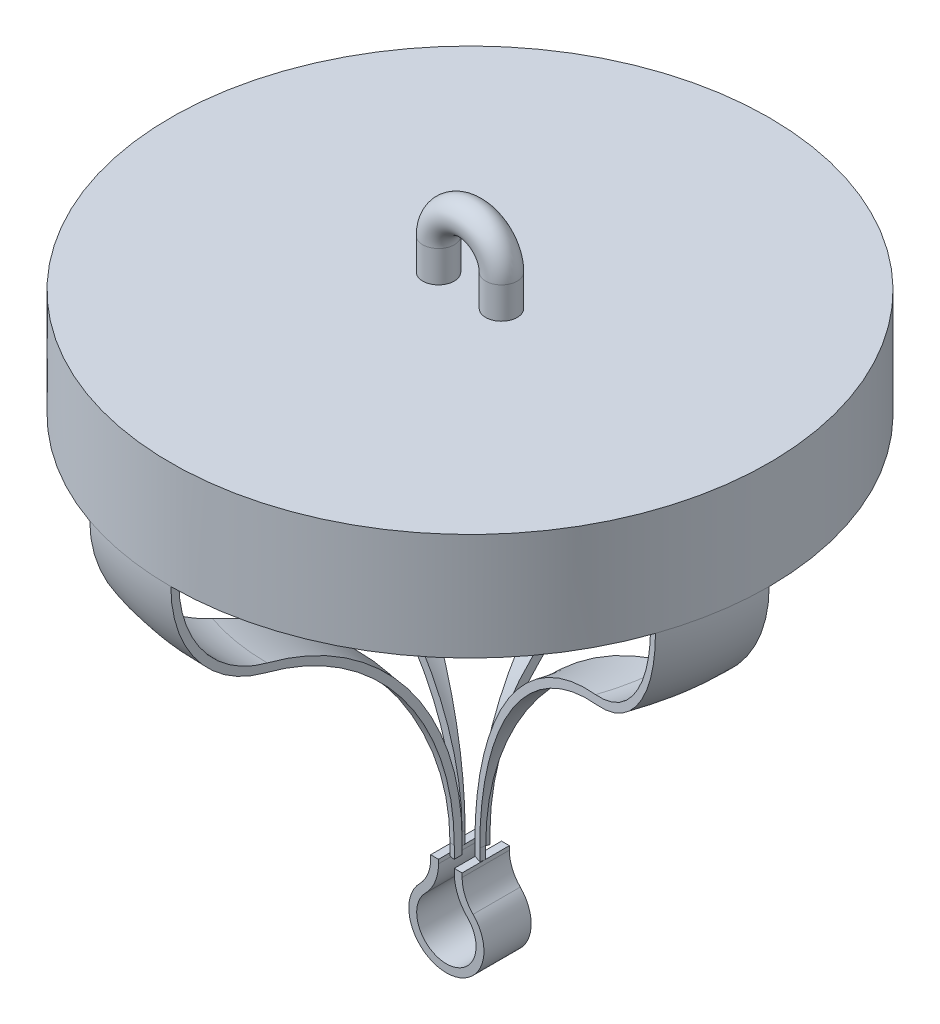
from build123d import *

# Parameters (mm, degrees)
SKETCH1_W           = 60.325
SKETCH1_H           = 21.59
REVOLVE2_ANGLE      = 19
CIRPATTERN2_COUNT   = 4
BOSS_EXTRUDE1_DEPTH = 4.7625
SKETCH8_R           = 3.175


with BuildPart() as part:
    # Sketch1 → Revolve1 (revolve)
    with BuildSketch(Plane.XY, mode=Mode.PRIVATE) as revolve1_sk:
        with Locations((30.1625, 10.795)):
            Rectangle(SKETCH1_W, SKETCH1_H)
    revolve(revolve1_sk.sketch.rotate(Axis((0, 0, 0), (0, 1, 0)), 90), axis=Axis((0, 0, 0), (0, 1, 0)))

    # Sketch4 → Revolve2 (revolve)
    with BuildSketch(Plane.XY):
        with BuildLine():
            Line((60.325, 0), (60.325, 6.35))
            Line((60.325, 6.35), (58.7375, 6.35))
            Line((58.7375, 6.35), (58.7375, 0))
            ThreePointArc((58.7375, 0), (53.750434196, -14.582118625), (40.878125, -23.056353983))
            ThreePointArc((40.878125, -23.056353983), (12.559044769, -41.69967177), (1.5875, -73.780332745))
            Line((1.5875, -73.780332745), (1.5875, -76.2))
            Line((1.5875, -76.2), (3.175, -76.2))
            Line((3.175, -76.2), (3.175, -73.780332745))
            ThreePointArc((3.175, -73.780332745), (13.814073716, -42.671813012), (41.275, -24.593444248))
            ThreePointArc((41.275, -24.593444248), (55.005463142, -15.554259867), (60.325, 0))
        make_face()
    revolve2 = revolve(axis=Axis((0, 0, 0), (0, -1, 0)), revolution_arc=REVOLVE2_ANGLE)

    # CirPattern2: Revolve2 ×4 about axis
    cirpattern2_axis = Axis((0, 0, 0), (0, 1, 0))
    for i in range(1, CIRPATTERN2_COUNT):
        add(revolve2.rotate(cirpattern2_axis, i * 360 / CIRPATTERN2_COUNT))

    # Sketch6 → Boss-Extrude1 (add, symmetric)
    with BuildSketch(Plane.XY):
        with BuildLine():
            Line((3.175, -76.2), (3.175, -76.99375))
            ThreePointArc((3.175, -76.99375), (3.746845437, -79.881464155), (5.376067541, -82.333307459))
            ThreePointArc((5.376067541, -82.333307459), (0, -95.25), (-5.376067541, -82.333307459))
            ThreePointArc((-5.376067541, -82.333307459), (-3.746845437, -79.881464155), (-3.175, -76.99375))
            Line((-3.175, -76.99375), (-3.175, -76.2))
            Line((-3.175, -76.2), (-1.5875, -76.2))
            Line((-1.5875, -76.2), (-1.5875, -76.99375))
            ThreePointArc((-1.5875, -76.99375), (-2.279153864, -80.486474647), (-4.249717393, -83.45200831))
            ThreePointArc((-4.249717393, -83.45200831), (0, -93.6625), (4.249717393, -83.45200831))
            ThreePointArc((4.249717393, -83.45200831), (2.279153864, -80.486474647), (1.5875, -76.99375))
            Line((1.5875, -76.99375), (1.5875, -76.2))
            Line((1.5875, -76.2), (3.175, -76.2))
        make_face()
    extrude(amount=BOSS_EXTRUDE1_DEPTH, both=True)

    # Sweep1: sweep along a path in Sketch7
    with BuildLine(Plane.XY) as sweep1_path:
        Line((6.35, 21.59), (6.35, 27.94))
        ThreePointArc((6.35, 27.94), (0, 34.29), (-6.35, 27.94))
        Line((-6.35, 27.94), (-6.35, 21.59))
    # Sketch8 → Sweep1 (sweep)
    with BuildSketch(Plane(origin=(0, 21.59, 0), x_dir=(1, 0, 0), z_dir=(0, 1, 0))):
        with Locations((6.35, 0)):
            Circle(SKETCH8_R)
    sweep(path=sweep1_path.line)


solid = part.part
